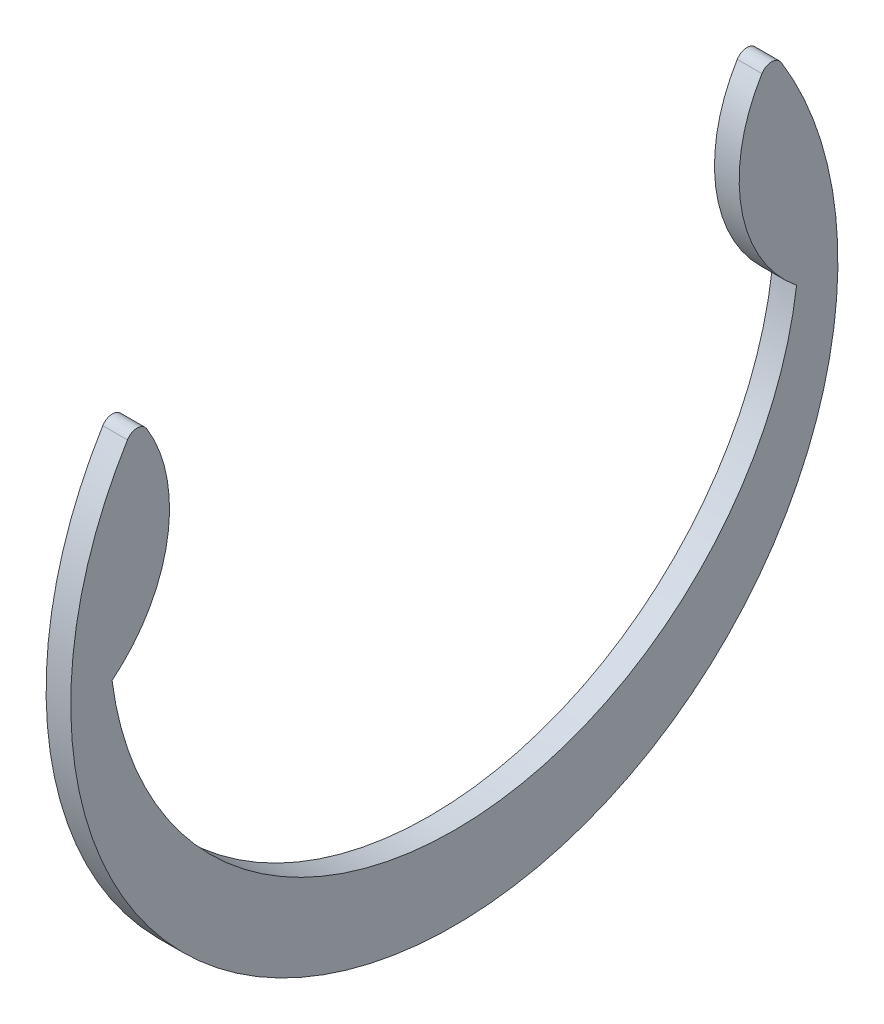
from build123d import *

# Parameters (mm, degrees)
EXTRUDE1_DEPTH = 0.635


with BuildPart() as part:
    # Sketch1 → Extrude1 (new, symmetric)
    with BuildSketch(Plane(origin=(0, 0, 0), x_dir=(0, 0, -1), z_dir=(1, 0, 0))):
        with BuildLine():
            ThreePointArc((-17.62125, 0), (0, -15.494), (17.62125, 0))
            ThreePointArc((17.62125, 0), (14.780353346, 4.827903405), (15.835947816, 10.329272816))
            ThreePointArc((15.835947816, 10.329272816), (16.333836683, 10.607954404), (16.831759419, 10.329333333))
            ThreePointArc((16.831759419, 10.329333333), (0, -19.7485), (-16.831759419, 10.329333333))
            ThreePointArc((-16.831759419, 10.329333333), (-16.333836683, 10.607954404), (-15.835947816, 10.329272816))
            ThreePointArc((-15.835947816, 10.329272816), (-14.780353346, 4.827903405), (-17.62125, 0))
        make_face()
    extrude(amount=EXTRUDE1_DEPTH, both=True)


solid = part.part
